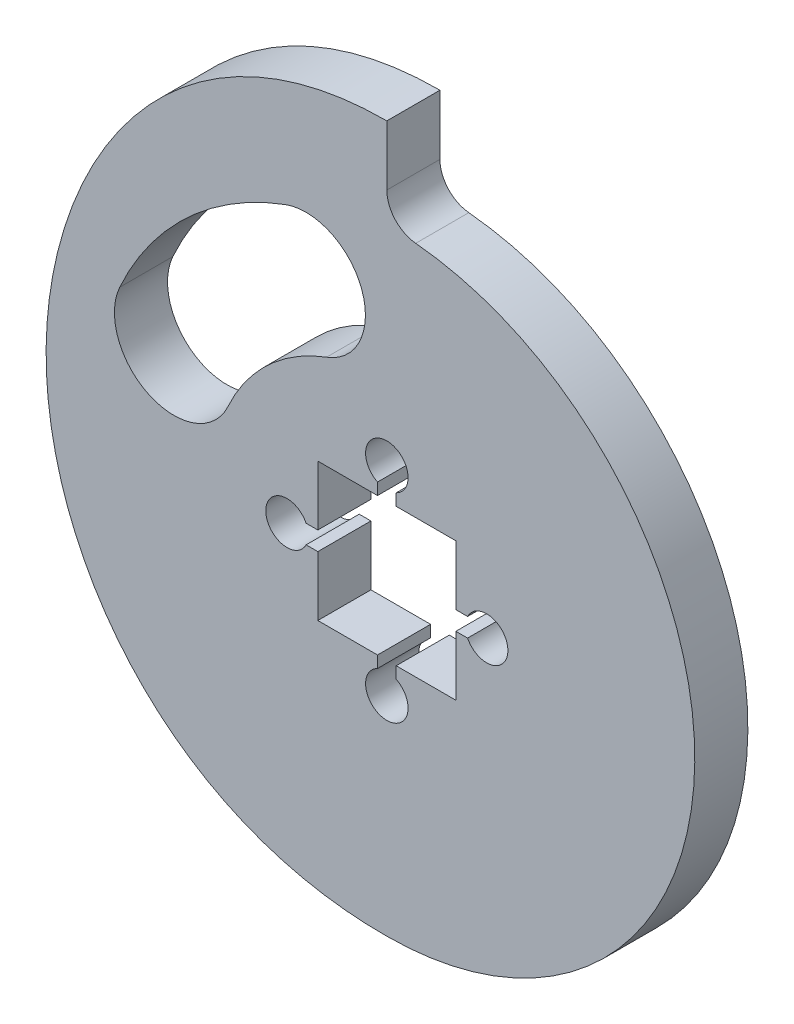
from build123d import *

# Parameters (mm, degrees)
BOSS_EXTRUDE1_DEPTH = 6.35
CUT_EXTRUDE1_DEPTH  = 64.001230115
FILLET2_R           = 3.81


with BuildPart() as part:
    # Sketch1 → Boss-Extrude1 (new body)
    with BuildSketch(Plane.XY):
        with BuildLine():
            Line((0, 47.625), (0, 36.83))
            ThreePointArc((0, 36.83), (36.83, 0), (0, -36.83))
            add(Edge.make_bspline(
                [(0, 47.625), (-26.600153249, 47.625), (-56.149642057, -0.404637175), (-24.15519568, -36.984078787), (0, -36.83)],
                knots=[0, 0, 0, 0, 0.529165327, 1, 1, 1, 1], degree=3))
        make_face()
        with BuildLine():
            Line((1.1176, -8.255), (8.255, -8.255))
            Line((8.255, -8.255), (8.255, -1.1176))
            Line((8.255, -1.1176), (9.657085657, -1.1176))
            ThreePointArc((9.657085657, -1.1176), (14.478, 0), (9.657085657, 1.1176))
            Line((9.657085657, 1.1176), (8.255, 1.1176))
            Line((8.255, 1.1176), (8.255, 8.255))
            Line((8.255, 8.255), (1.1176, 8.255))
            Line((1.1176, 8.255), (1.1176, 9.657085657))
            ThreePointArc((1.1176, 9.657085657), (0, 14.478), (-1.1176, 9.657085657))
            Line((-1.1176, 9.657085657), (-1.1176, 8.255))
            Line((-1.1176, 8.255), (-8.255, 8.255))
            Line((-8.255, 8.255), (-8.255, 1.1176))
            Line((-8.255, 1.1176), (-9.657085657, 1.1176))
            ThreePointArc((-9.657085657, 1.1176), (-14.478, 0), (-9.657085657, -1.1176))
            Line((-9.657085657, -1.1176), (-8.255, -1.1176))
            Line((-8.255, -1.1176), (-8.255, -8.255))
            Line((-8.255, -8.255), (-1.1176, -8.255))
            Line((-1.1176, -8.255), (-1.1176, -9.657085657))
            ThreePointArc((-1.1176, -9.657085657), (0, -14.478), (1.1176, -9.657085657))
            Line((1.1176, -9.657085657), (1.1176, -8.255))
        make_face(mode=Mode.SUBTRACT)
    extrude(amount=BOSS_EXTRUDE1_DEPTH)

    # Sketch5 → Cut-Extrude1 (cut, through all)
    with BuildSketch(Plane.XY.offset(6.35)):
        with BuildLine():
            ThreePointArc((-12.136378722, 32.883902073), (-23.899090909, 25.641297895), (-31.950108913, 14.416422734))
            ThreePointArc((-31.950108913, 14.416422734), (-28.392549398, 5.00872066), (-18.984847325, 8.566280175))
            ThreePointArc((-18.984847325, 8.566280175), (-14.200909091, 15.236133532), (-7.211471414, 19.539709927))
            ThreePointArc((-7.211471414, 19.539709927), (-3.001828995, 28.674259654), (-12.136378722, 32.883902073))
        make_face()
    extrude(amount=-CUT_EXTRUDE1_DEPTH, mode=Mode.SUBTRACT)

    # Fillet2
    fillet2_edges = [part.edges().sort_by_distance(p)[0] for p in [
        (0, 36.83, 3.175),
    ]]
    fillet(fillet2_edges, radius=FILLET2_R)


solid = part.part
